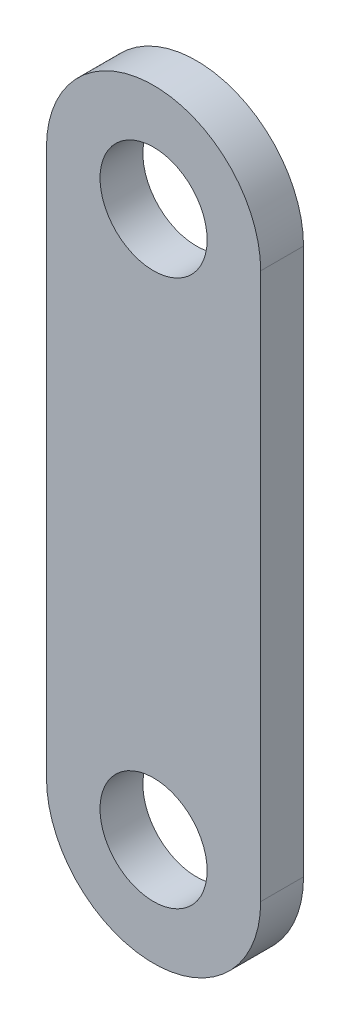
from build123d import *

# Parameters (mm, degrees)
EXTRUDE_1_DEPTH      = 10
EXTRUDE_1_DEPTH_BACK = 10
SKETCH_1_R           = 25


with BuildPart() as part:
    # 草圖1 → 擠出1 (new, two sides: drawn at the far end of the back side and taken through both)
    with BuildSketch(Plane.XY.offset(-EXTRUDE_1_DEPTH_BACK)):
        with BuildLine():
            Line((50, 0), (50, 255))
            ThreePointArc((50, 255), (0, 305), (-50, 255))
            Line((-50, 255), (-50, 0))
            ThreePointArc((-50, 0), (0, -50), (50, 0))
        make_face()
        Circle(SKETCH_1_R, mode=Mode.SUBTRACT)
        with Locations((0, 255)):
            Circle(SKETCH_1_R, mode=Mode.SUBTRACT)
    extrude(amount=EXTRUDE_1_DEPTH + EXTRUDE_1_DEPTH_BACK)


solid = part.part
